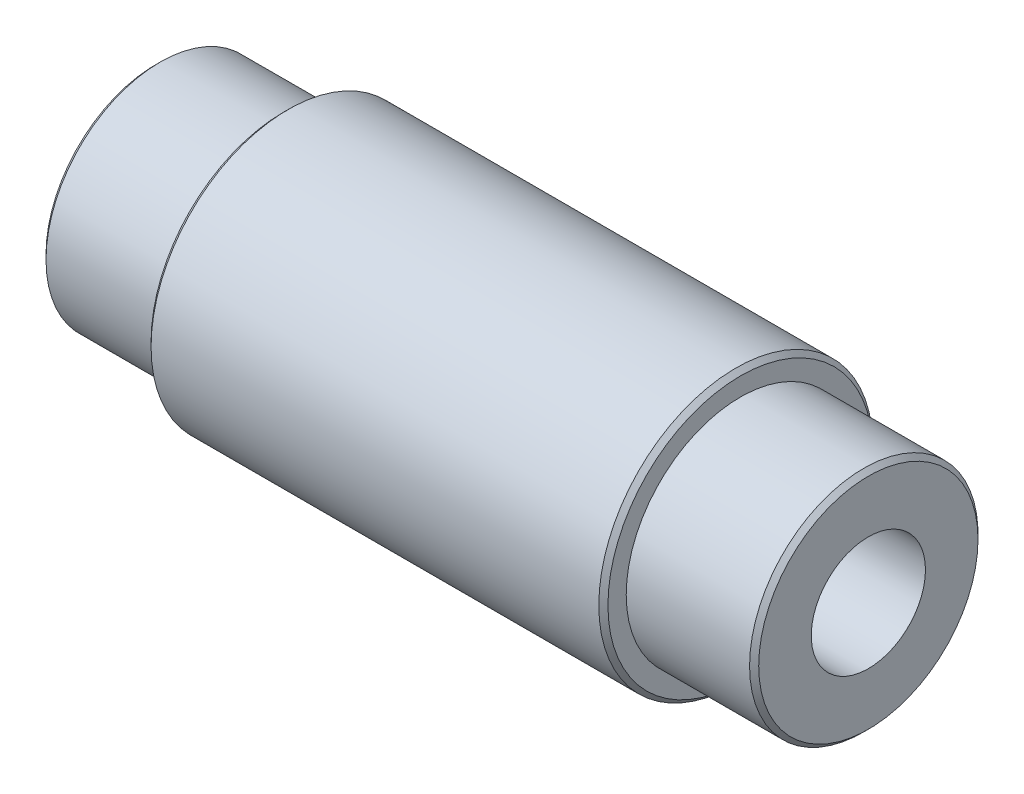
from build123d import *

# Parameters (mm, degrees)
HOLE_WIZARD_M3_2_D     = 2.5
HOLE_WIZARD_M3_2_DEPTH = 6
HOLE_WIZARD_M3_2_TIP   = 0.751075774
HOLE_WIZARD_M3_3_D     = 2.5
HOLE_WIZARD_M3_3_DEPTH = 6.5
HOLE_WIZARD_M3_3_TIP   = 0.751075774
CHAMFER_1_SIZE         = 0.1


with BuildPart() as part:
    # 草图2 → 旋转1 (revolve)
    with BuildSketch(Plane.XY, mode=Mode.PRIVATE) as revolve_1_sk:
        Polygon((-7.8, 0), (-7.8, 2.5), (-5, 2.5), (-5, 3), (5, 3), (5, 2.5), (7.8, 2.5), (7.8, 0), align=None)
    revolve(revolve_1_sk.sketch.rotate(Axis((-7.8, 0, 0), (1, 0, 0)), 90), axis=Axis((-7.8, 0, 0), (1, 0, 0)))

    # M3 螺纹孔2
    with Locations(Plane.ZY.offset(7.8)):
        with Locations((0, 0)):
            Hole(HOLE_WIZARD_M3_2_D / 2, depth=HOLE_WIZARD_M3_2_DEPTH)
            with Locations((0, 0, -(HOLE_WIZARD_M3_2_DEPTH + HOLE_WIZARD_M3_2_TIP / 2))):  # 118° drill point
                Cone(0, HOLE_WIZARD_M3_2_D / 2, HOLE_WIZARD_M3_2_TIP, mode=Mode.SUBTRACT)

    # M3 螺纹孔3
    with Locations(Plane(origin=(7.8, 0, 0), x_dir=(0, 0, -1), z_dir=(1, 0, 0))):
        with Locations((0, 0)):
            Hole(HOLE_WIZARD_M3_3_D / 2, depth=HOLE_WIZARD_M3_3_DEPTH)
            with Locations((0, 0, -(HOLE_WIZARD_M3_3_DEPTH + HOLE_WIZARD_M3_3_TIP / 2))):  # 118° drill point
                Cone(0, HOLE_WIZARD_M3_3_D / 2, HOLE_WIZARD_M3_3_TIP, mode=Mode.SUBTRACT)

    # 倒角1
    chamfer_1_edges = [part.edges().sort_by_distance(p)[0] for p in [
        (7.8, 0, -2.5),
        (5, 0, -3),
        (-5, 0, -3),
        (-7.8, 0, -2.5),
    ]]
    chamfer(chamfer_1_edges, length=CHAMFER_1_SIZE)


solid = part.part
